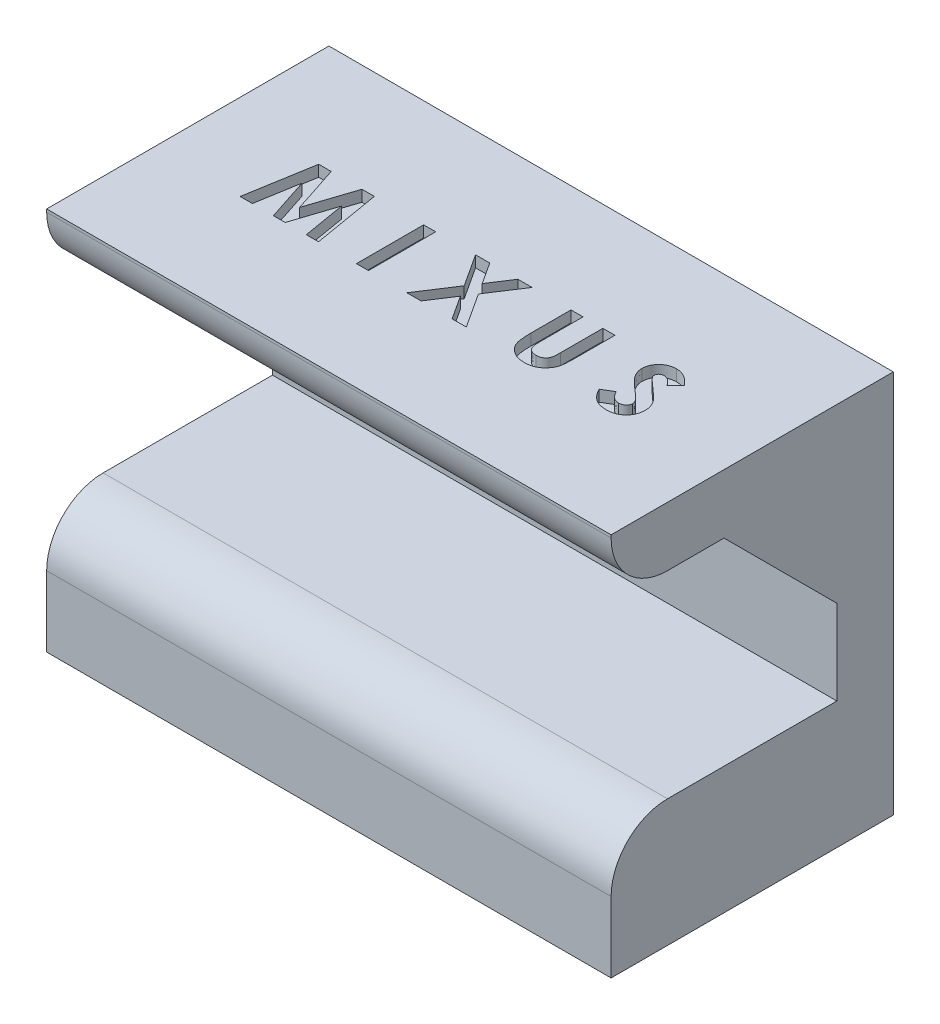
from build123d import *

# Parameters (mm, degrees)
ESQUISSE1_W                                       = 100
ESQUISSE1_H                                       = 68
BOSS_EXTRU_1_DEPTH                                = 25
ESQUISSE2_W                                       = 100
ESQUISSE2_H                                       = 35
ENL_V_MAT_EXTRU_1_DEPTH                           = 40
FRAISAGE_POUR_VIS_T_TE_FRAIS_E_BOMB_E_D           = 3.7973
FRAISAGE_POUR_VIS_T_TE_FRAIS_E_BOMB_E_CSINK_D     = 7.0866
FRAISAGE_POUR_VIS_T_TE_FRAIS_E_BOMB_E_CSINK_ANGLE = 82
CONG_1_R                                          = 10
NERVURE1_REACH                                    = 110.54
ESQUISSE5_WALL_W                                  = 247.364901428
ESQUISSE5_WALL_H                                  = 5
ESQUISSE6_W                                       = 2.13701923
ESQUISSE6_H                                       = 11.90625
ENL_V_MAT_EXTRU_2_DEPTH                           = 2


with BuildPart() as part:
    # Esquisse1 → Boss.-Extru.1 (new, symmetric)
    with BuildSketch(Plane.XY):
        Rectangle(ESQUISSE1_W, ESQUISSE1_H)
    extrude(amount=BOSS_EXTRU_1_DEPTH, both=True)

    # Esquisse2 → Enlèv. mat.-Extru.1 (cut)
    with BuildSketch(Plane.XY.offset(25)):
        with Locations((0, 6)):
            Rectangle(ESQUISSE2_W, ESQUISSE2_H)
    extrude(amount=-ENL_V_MAT_EXTRU_1_DEPTH, mode=Mode.SUBTRACT)

    # Fraisage pour vis à tête fraisée bombée #61 (through all)
    with Locations(Plane.XY.offset(-15)):
        with Locations((-20, 6), (20, 6)):
            CounterSinkHole(FRAISAGE_POUR_VIS_T_TE_FRAIS_E_BOMB_E_D / 2, FRAISAGE_POUR_VIS_T_TE_FRAIS_E_BOMB_E_CSINK_D / 2, counter_sink_angle=FRAISAGE_POUR_VIS_T_TE_FRAIS_E_BOMB_E_CSINK_ANGLE)

    # Congé1
    cong_1_edges = [part.edges().sort_by_distance(p)[0] for p in [
        (0, -11.5, 25),
        (0, 23.5, 25),
    ]]
    fillet(cong_1_edges, radius=CONG_1_R)

    # Esquisse5 wall → Nervure1 (add, up to next)
    with BuildSketch(Plane(origin=(50, 13.5, -5), x_dir=(0, -0.707106781187, -0.707106781187), z_dir=(0, 0.707106781187, -0.707106781187)), mode=Mode.PRIVATE) as nervure1_sk1:
        with Locations((0, 2.5)):
            Rectangle(ESQUISSE5_WALL_W, ESQUISSE5_WALL_H)
    nervure1_tool1 = extrude(nervure1_sk1.sketch, amount=NERVURE1_REACH, mode=Mode.PRIVATE) - part.part
    nervure1 = nervure1_tool1.solids().sort_by_distance((50, 13.5, -5))[0]
    add(nervure1)

    # Symétrie1: Nervure1 across plane
    add(nervure1.mirror(Plane(origin=(0, 0, 0), x_dir=(0, 0, 1), z_dir=(1, 0, 0))))

    # Esquisse6 → Enlèv. mat.-Extru.2 (cut)
    with BuildSketch(Plane(origin=(0, 34, 0), x_dir=(1, 0, 0), z_dir=(0, 1, 0))):
        Polygon((-32.762571201, 5.954927128), (-30.544459723, 5.954927128), (-27.827869428, -2.349873052), (-25.092198605, 5.954927128), (-22.895552722, 5.954927128), (-20.882556928, -5.951322872), (-23.045811886, -5.951322872), (-24.317052121, 1.568790559), (-26.792750738, -5.951322872), (-28.877298515, -5.951322872), (-31.338686736, 1.568790559), (-32.607541904, -5.951322872), (-34.773181928, -5.951322872), align=None)
        with Locations((-13.097701159, 0.001802128)):
            Rectangle(ESQUISSE6_W, ESQUISSE6_H)
        Polygon((-4.971780937, 5.954927128), (-2.453151129, 5.954927128), (0.034472819, 2.13166616), (2.5268669, 5.954927128), (5.047881774, 5.954927128), (1.293787723, 0.197377549), (5.295928649, -5.951322872), (2.777298841, -5.951322872), (0.034472819, -1.734525997), (-2.715508401, -5.951322872), (-5.236523274, -5.951322872), (-1.224842085, 0.199762615), align=None)
        with BuildLine():
            Line((11.935952687, 5.954927128), (14.072971918, 5.954927128))
            Line((14.072971918, 5.954927128), (14.072971918, -1.791767584))
            add(Edge.make_bspline(
                [(14.072971918, -1.791767584), (14.073088118, -1.872081954), (14.073312559, -2.027208332), (14.084548152, -2.249763894), (14.094829494, -2.454339054), (14.113379954, -2.640709846), (14.140785342, -2.808955992), (14.167322699, -2.960158246), (14.203238389, -3.091609503), (14.257213928, -3.241235447), (14.340372515, -3.409348368), (14.476249032, -3.584559511), (14.633038909, -3.74446511), (14.820960608, -3.877564472), (15.032167977, -3.98522986), (15.265500528, -4.064997997), (15.520629344, -4.109338489), (15.697036925, -4.116107878), (15.787834448, -4.119592103)],
                knots=[0, 0, 0, 0, 1.155499968, 2.231836252, 3.205919964, 4.102923608, 4.924856345, 5.658536265, 6.31071849, 6.882491295, 7.94666036, 8.992281882, 10.060072772, 11.158554251, 12.289267114, 13.461410017, 14.693379945, 16, 16, 16, 16], degree=3))
            add(Edge.make_bspline(
                [(15.787834448, -4.119592103), (15.884295611, -4.116777296), (16.072378549, -4.1112889), (16.342905913, -4.05741435), (16.593551049, -3.971627616), (16.819006947, -3.849188084), (17.01904924, -3.702422846), (17.188380849, -3.535064484), (17.322016733, -3.346779199), (17.40911563, -3.173071686), (17.458017372, -3.013189048), (17.494671663, -2.870339977), (17.521543314, -2.701792214), (17.545922158, -2.510177994), (17.560571966, -2.293512565), (17.576457294, -2.053538377), (17.582279414, -1.788613462), (17.583271752, -1.604141271), (17.583789226, -1.507944717)],
                knots=[0, 0, 0, 0, 1.261321664, 2.459363699, 3.594844139, 4.716940403, 5.803436589, 6.833651888, 7.818396249, 8.814403945, 9.360733334, 10.004355033, 10.743453831, 11.592799886, 12.532235708, 13.585170094, 14.740740724, 16, 16, 16, 16], degree=3))
            Line((17.583789226, -1.507944717), (17.583789226, 5.954927128))
            Line((17.583789226, 5.954927128), (19.720808456, 5.954927128))
            Line((19.720808456, 5.954927128), (19.720808456, -1.147799735))
            add(Edge.make_bspline(
                [(19.720808456, -1.147799735), (19.720511692, -1.291700642), (19.719941044, -1.568408051), (19.711177609, -1.966056071), (19.69252184, -2.329243752), (19.676853147, -2.658077216), (19.646528858, -2.95211347), (19.614938064, -3.212608133), (19.574672878, -3.438638071), (19.514760703, -3.695945686), (19.411370026, -3.992225983), (19.2446907, -4.3333799), (19.033102083, -4.667390249), (18.783014913, -4.990582687), (18.500643621, -5.290818046), (18.192248984, -5.55438583), (17.862730626, -5.777335753), (17.508645316, -5.954216422), (17.1302944, -6.09217001), (16.723934376, -6.184867872), (16.289842351, -6.247495711), (15.990006784, -6.253511886), (15.83553577, -6.256611334)],
                knots=[0, 0, 0, 0, 1.170808336, 2.251350247, 3.235597562, 4.129743112, 4.929140599, 5.639994148, 6.264258765, 6.79612947, 7.788252245, 8.809469599, 9.879094798, 10.999557536, 12.129761673, 13.226370002, 14.293821979, 15.358369427, 16.438775801, 17.562147481, 18.744053101, 20, 20, 20, 20], degree=3))
            add(Edge.make_bspline(
                [(15.83553577, -6.256611334), (15.732902155, -6.254882606), (15.530408139, -6.251471862), (15.232605165, -6.221398006), (14.94472009, -6.177080452), (14.667293849, -6.112425704), (14.399363547, -6.028903846), (14.141000368, -5.926094254), (13.89316445, -5.804570389), (13.657242649, -5.665450007), (13.433525288, -5.515015263), (13.229059167, -5.348252016), (13.036808128, -5.177493039), (12.862326224, -4.995552068), (12.70430294, -4.804339174), (12.563063724, -4.603421006), (12.438818412, -4.39281541), (12.328441681, -4.168726233), (12.233969972, -3.91976383), (12.154326772, -3.637072507), (12.084748599, -3.316221358), (12.033042206, -2.956487525), (11.986164886, -2.559056648), (11.956494127, -2.122893361), (11.940972018, -1.647985149), (11.937668074, -1.318741131), (11.935952687, -1.147799735)],
                knots=[0, 0, 0, 0, 1.001158378, 1.975264943, 2.917723546, 3.841610987, 4.75185031, 5.653588123, 6.552117133, 7.442167995, 8.324307438, 9.179605724, 10.014504199, 10.831958861, 11.636465792, 12.43274043, 13.225645099, 14.020104002, 14.867201867, 15.819789774, 16.883317127, 18.068162734, 19.364263498, 20.787406516, 22.332041935, 24, 24, 24, 24], degree=3))
            Line((11.935952687, -1.147799735), (11.935952687, 5.954927128))
        make_face()
        with BuildLine():
            Line((33.611433456, 4.364088035), (32.013439165, 2.902042513))
            add(Edge.make_bspline(
                [(32.013439165, 2.902042513), (31.944987942, 2.998600079), (31.813571139, 3.183977142), (31.600558208, 3.432201399), (31.388507141, 3.643955162), (31.175453411, 3.818353823), (30.959508593, 3.95433778), (30.741047534, 4.050615924), (30.521308752, 4.111820853), (30.373678211, 4.11944234), (30.300961701, 4.123196359)],
                knots=[0, 0, 0, 0, 1.299362458, 2.494594718, 3.587462134, 4.587049575, 5.512617175, 6.380583204, 7.202344345, 8, 8, 8, 8], degree=3))
            add(Edge.make_bspline(
                [(30.300961701, 4.123196359), (30.233133828, 4.12081764), (30.102176023, 4.116224959), (29.915485958, 4.070574053), (29.749739859, 3.991787293), (29.605099488, 3.888766977), (29.490522974, 3.764651379), (29.399042513, 3.63448603), (29.347531326, 3.490812923), (29.34075144, 3.392132436), (29.337394995, 3.343279742)],
                knots=[0, 0, 0, 0, 1.185010067, 2.2879431, 3.333075148, 4.379039566, 5.372662701, 6.27520591, 7.14612461, 8, 8, 8, 8], degree=3))
            add(Edge.make_bspline(
                [(29.337394995, 3.343279742), (29.339498309, 3.29372257), (29.343734092, 3.193921313), (29.384645987, 3.047650141), (29.446311895, 2.904726179), (29.505236187, 2.817721562), (29.535355482, 2.773248943)],
                knots=[0, 0, 0, 0, 0.967525499, 1.948461899, 2.951351359, 4, 4, 4, 4], degree=3))
            add(Edge.make_bspline(
                [(29.535355482, 2.773248943), (29.562737178, 2.738680841), (29.625766227, 2.659109636), (29.745949715, 2.533081252), (29.896874934, 2.378685449), (30.084349806, 2.201231447), (30.300591733, 1.994337307), (30.555623808, 1.766136116), (30.842105095, 1.509560747), (31.045729356, 1.330890951), (31.152430301, 1.237266371)],
                knots=[0, 0, 0, 0, 0.473873513, 1.090794244, 1.870441696, 2.795289791, 3.865433203, 5.087734844, 6.473946851, 8, 8, 8, 8], degree=3))
            add(Edge.make_bspline(
                [(31.152430301, 1.237266371), (31.252584487, 1.150587975), (31.442656324, 0.986090387), (31.713090804, 0.752612473), (31.950757671, 0.542558086), (32.15911919, 0.359079694), (32.335016802, 0.200252189), (32.479189983, 0.065316376), (32.593399563, -0.043100793), (32.658321022, -0.108584828), (32.686027807, -0.136531706)],
                knots=[0, 0, 0, 0, 1.543621617, 2.929473131, 4.163658386, 5.240097082, 6.164993805, 6.925417477, 7.541396219, 8, 8, 8, 8], degree=3))
            add(Edge.make_bspline(
                [(32.686027807, -0.136531706), (32.791141572, -0.250287312), (32.993207143, -0.468965536), (33.255821152, -0.807848009), (33.471960976, -1.138666403), (33.639170843, -1.467645602), (33.76545446, -1.799532121), (33.854486082, -2.142465458), (33.907807713, -2.500029053), (33.913727659, -2.744022556), (33.916721918, -2.867432397)],
                knots=[0, 0, 0, 0, 1.206664779, 2.319633467, 3.337109185, 4.282041471, 5.190008762, 6.099243693, 7.03861361, 8, 8, 8, 8], degree=3))
            add(Edge.make_bspline(
                [(33.916721918, -2.867432397), (33.914590681, -2.987680152), (33.910409116, -3.223610723), (33.859192961, -3.56885997), (33.78616173, -3.899278484), (33.673242634, -4.211270843), (33.53561751, -4.509958308), (33.363084539, -4.790688277), (33.160468223, -5.056301853), (32.928238814, -5.302050867), (32.671365511, -5.525051064), (32.395844482, -5.723571107), (32.098981542, -5.887474689), (31.783313042, -6.022437597), (31.449007951, -6.126387834), (31.096464529, -6.203216747), (30.725143535, -6.24932825), (30.471228889, -6.25414866), (30.341507825, -6.256611334)],
                knots=[0, 0, 0, 0, 1.043214005, 2.046824704, 3.02475056, 3.976699089, 4.921714032, 5.875962561, 6.831408892, 7.817874052, 8.806269674, 9.781291748, 10.760897367, 11.74438705, 12.757449933, 13.795994037, 14.874007457, 16, 16, 16, 16], degree=3))
            add(Edge.make_bspline(
                [(30.341507825, -6.256611334), (30.239677895, -6.254804803), (30.037996233, -6.251226836), (29.740747954, -6.222015713), (29.453721139, -6.174872069), (29.177239097, -6.107301144), (28.910056229, -6.021679617), (28.652161561, -5.917096203), (28.405335426, -5.791929896), (28.16771022, -5.648754614), (27.940441095, -5.482509253), (27.720654323, -5.296592643), (27.510533033, -5.088145305), (27.309068058, -4.857660209), (27.117548424, -4.604484675), (26.929705009, -4.332144642), (26.753886137, -4.035585849), (26.645274999, -3.827547456), (26.589798841, -3.721286063)],
                knots=[0, 0, 0, 0, 1.016823716, 2.013894106, 2.979844003, 3.91962641, 4.853723003, 5.779685073, 6.695824784, 7.614987388, 8.547259901, 9.504950863, 10.487499108, 11.500346958, 12.559593716, 13.656357062, 14.802919212, 16, 16, 16, 16], degree=3))
            Line((26.589798841, -3.721286063), (28.469230932, -2.593149795))
            add(Edge.make_bspline(
                [(28.469230932, -2.593149795), (28.538623315, -2.71377036), (28.671654443, -2.945010291), (28.897088126, -3.255710447), (29.128033426, -3.521773701), (29.369829591, -3.738497366), (29.61953647, -3.908779318), (29.878360205, -4.030474614), (30.14648264, -4.105803865), (30.329115463, -4.115003306), (30.420215007, -4.119592103)],
                knots=[0, 0, 0, 0, 1.283663364, 2.460892379, 3.537111102, 4.529833553, 5.449777664, 6.316464042, 7.160231139, 8, 8, 8, 8], degree=3))
            add(Edge.make_bspline(
                [(30.420215007, -4.119592103), (30.512876285, -4.115844643), (30.69265266, -4.108574024), (30.949260431, -4.041417511), (31.184528151, -3.935976859), (31.387891831, -3.785527588), (31.560087373, -3.611886263), (31.687177567, -3.41870235), (31.767016484, -3.209682019), (31.775457393, -3.064482748), (31.779702687, -2.991455835)],
                knots=[0, 0, 0, 0, 1.13588714, 2.203786484, 3.234766741, 4.283437687, 5.291419208, 6.222934724, 7.106237994, 8, 8, 8, 8], degree=3))
            add(Edge.make_bspline(
                [(31.779702687, -2.991455835), (31.775782332, -2.923516176), (31.767818506, -2.785503262), (31.70915942, -2.580300253), (31.617457377, -2.375190566), (31.508967393, -2.206954051), (31.39856525, -2.066094178), (31.2929959, -1.94404547), (31.164440358, -1.809203014), (31.013224584, -1.661397189), (30.841346533, -1.499326822), (30.64866142, -1.323007786), (30.432962798, -1.133993238), (30.280506586, -1.005238395), (30.200788925, -0.937913918)],
                knots=[0, 0, 0, 0, 0.916159276, 1.861089862, 2.860218735, 3.940849679, 4.552606315, 5.27541173, 6.11797699, 7.06649574, 8.129236253, 9.306560635, 10.591630461, 12, 12, 12, 12], degree=3))
            add(Edge.make_bspline(
                [(30.200788925, -0.937913918), (30.049242479, -0.809691093), (29.75837898, -0.563592681), (29.347351954, -0.200113074), (28.9769798, 0.139591924), (28.650461451, 0.459721809), (28.363636557, 0.754364525), (28.118447622, 1.025913272), (27.917588157, 1.276462677), (27.70622688, 1.573221681), (27.505391409, 1.934842919), (27.33181257, 2.369915189), (27.219201945, 2.804932254), (27.20658549, 3.096978752), (27.200375764, 3.2407219)],
                knots=[0, 0, 0, 0, 1.345494975, 2.582412109, 3.71882943, 4.751509156, 5.681369928, 6.505683931, 7.230279997, 7.856715994, 8.973648664, 10.023341002, 11.027102913, 12, 12, 12, 12], degree=3))
            add(Edge.make_bspline(
                [(27.200375764, 3.2407219), (27.202958381, 3.342656825), (27.208046414, 3.543479577), (27.253432451, 3.838760174), (27.321263614, 4.123681139), (27.419773935, 4.397202952), (27.547628438, 4.658983015), (27.702902765, 4.910302851), (27.888008032, 5.14884937), (28.096609173, 5.374464432), (28.326434221, 5.580650924), (28.572031493, 5.762631163), (28.832010884, 5.916334319), (29.104781973, 6.043842248), (29.392035009, 6.141441467), (29.691653812, 6.210624659), (30.00406813, 6.251772615), (30.216565605, 6.257366202), (30.324812363, 6.26021559)],
                knots=[0, 0, 0, 0, 1.010766082, 1.991317756, 2.957454644, 3.913069143, 4.869106762, 5.843196583, 6.838735724, 7.860187025, 8.887984031, 9.89767229, 10.887916223, 11.879572884, 12.879850636, 13.892031539, 14.926195476, 16, 16, 16, 16], degree=3))
            add(Edge.make_bspline(
                [(30.324812363, 6.26021559), (30.465094803, 6.255083759), (30.744552342, 6.244860607), (31.157738374, 6.164918897), (31.561321215, 6.039202138), (31.886535832, 5.8875387), (32.145303032, 5.740622256), (32.343623919, 5.605360101), (32.545426096, 5.450410032), (32.752336973, 5.275283761), (32.960511826, 5.076681679), (33.17587006, 4.859331665), (33.395477157, 4.621355307), (33.53818695, 4.4513461), (33.611433456, 4.364088035)],
                knots=[0, 0, 0, 0, 1.282922637, 2.555718331, 3.837320111, 5.142675274, 5.830281639, 6.55870424, 7.337177975, 8.157850921, 9.037902056, 9.96903443, 10.957596896, 12, 12, 12, 12], degree=3))
        make_face()
    extrude(amount=-ENL_V_MAT_EXTRU_2_DEPTH, mode=Mode.SUBTRACT)


solid = part.part
